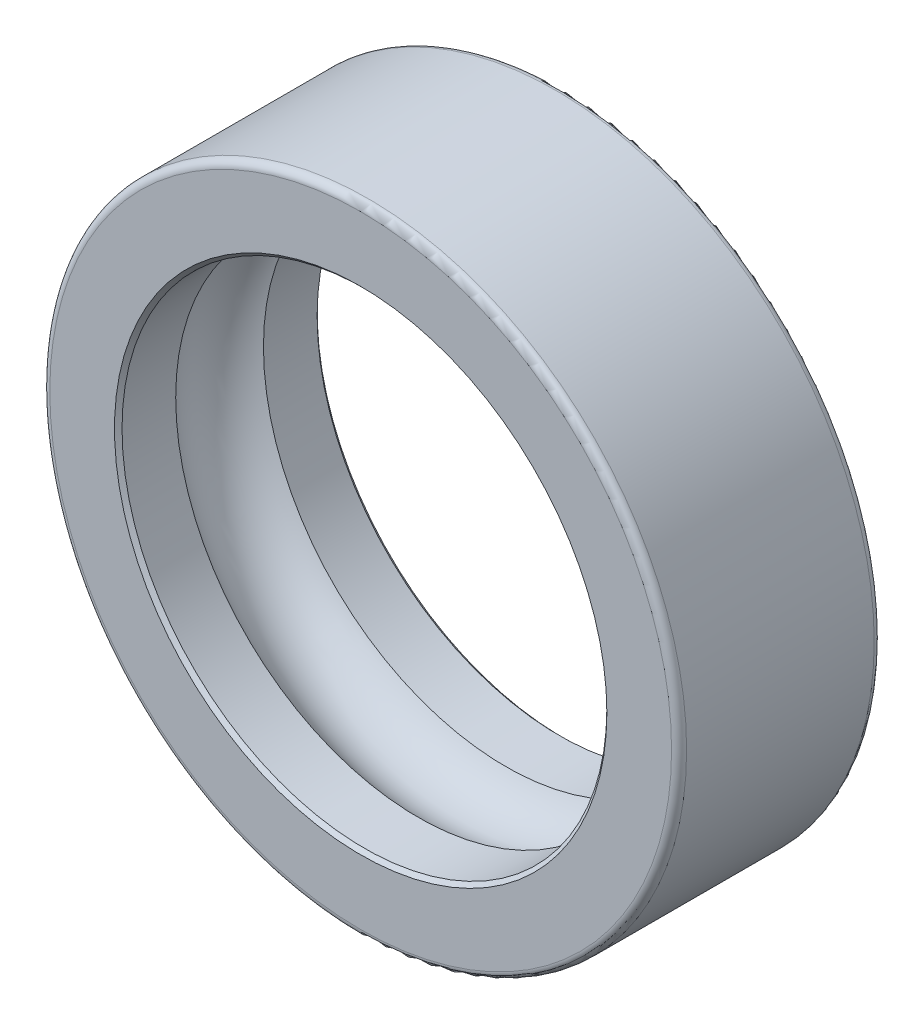
from build123d import *


with BuildPart() as part:
    # Sketch1 → Revolve1 (revolve)
    with BuildSketch(Plane(origin=(0, 0, 0), x_dir=(0, 0, -1), z_dir=(1, 0, 0)), mode=Mode.PRIVATE) as revolve1_sk:
        with BuildLine():
            Line((-3.37, 8.375), (-1.515544457, 8.375))
            ThreePointArc((-1.515544457, 8.375), (0, 9.25), (1.515544457, 8.375))
            Line((1.515544457, 8.375), (3.37, 8.375))
            Line((3.37, 8.375), (3.5, 8.505))
            Line((3.5, 8.505), (3.5, 10.74))
            ThreePointArc((3.5, 10.74), (3.423847763, 10.923847763), (3.24, 11))
            Line((3.24, 11), (-3.24, 11))
            ThreePointArc((-3.24, 11), (-3.423847763, 10.923847763), (-3.5, 10.74))
            Line((-3.5, 10.74), (-3.5, 8.505))
            Line((-3.5, 8.505), (-3.37, 8.375))
        make_face()
    revolve(revolve1_sk.sketch.rotate(Axis((0, 0, 3.5), (0, 0, -1)), 90), axis=Axis((0, 0, 3.5), (0, 0, -1)))


solid = part.part
